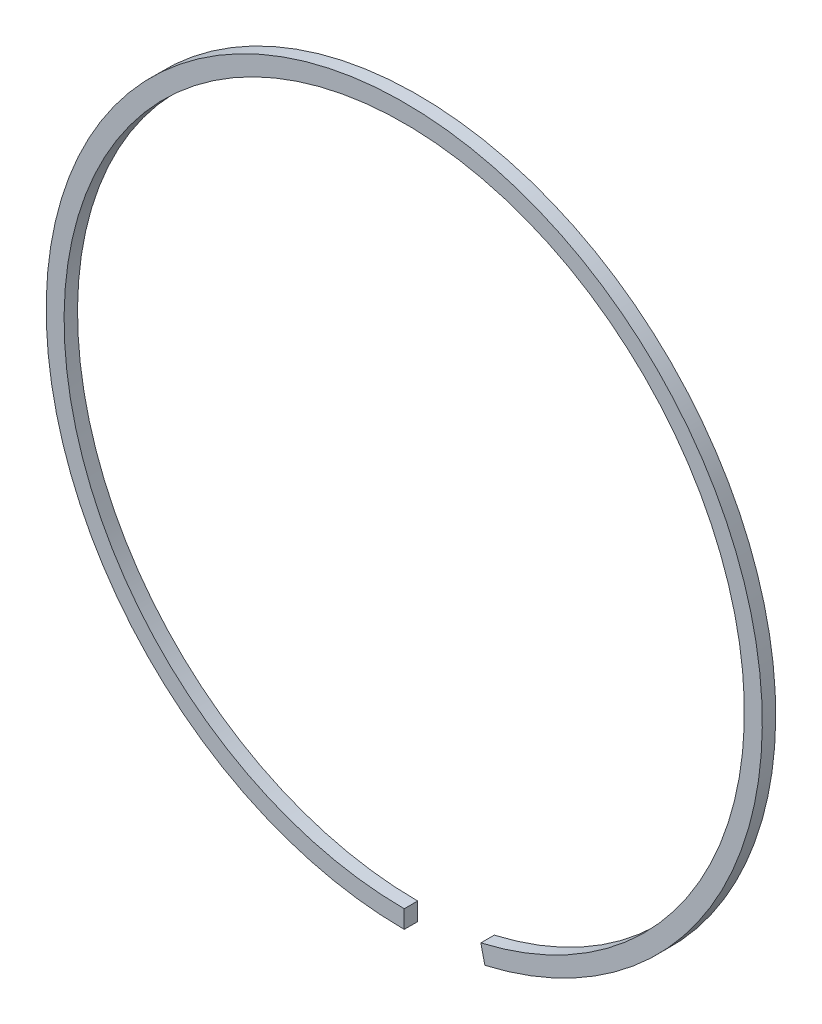
from build123d import *

# Parameters (mm, degrees)
SALIENTE_EXTRUIR1_DEPTH = 1.5


with BuildPart() as part:
    # Croquis1 → Saliente-Extruir1 (new body)
    with BuildSketch(Plane.XY):
        with BuildLine():
            Line((8.556154038, -37.024211377), (9.006477934, -38.972854081))
            ThreePointArc((9.006477934, -38.972854081), (-4.532429633, 39.742383945), (0, -40))
            Line((0, -40), (0, -38))
            ThreePointArc((0, -38), (-4.305808152, 37.755264748), (8.556154038, -37.024211377))
        make_face()
    extrude(amount=SALIENTE_EXTRUIR1_DEPTH)


solid = part.part
